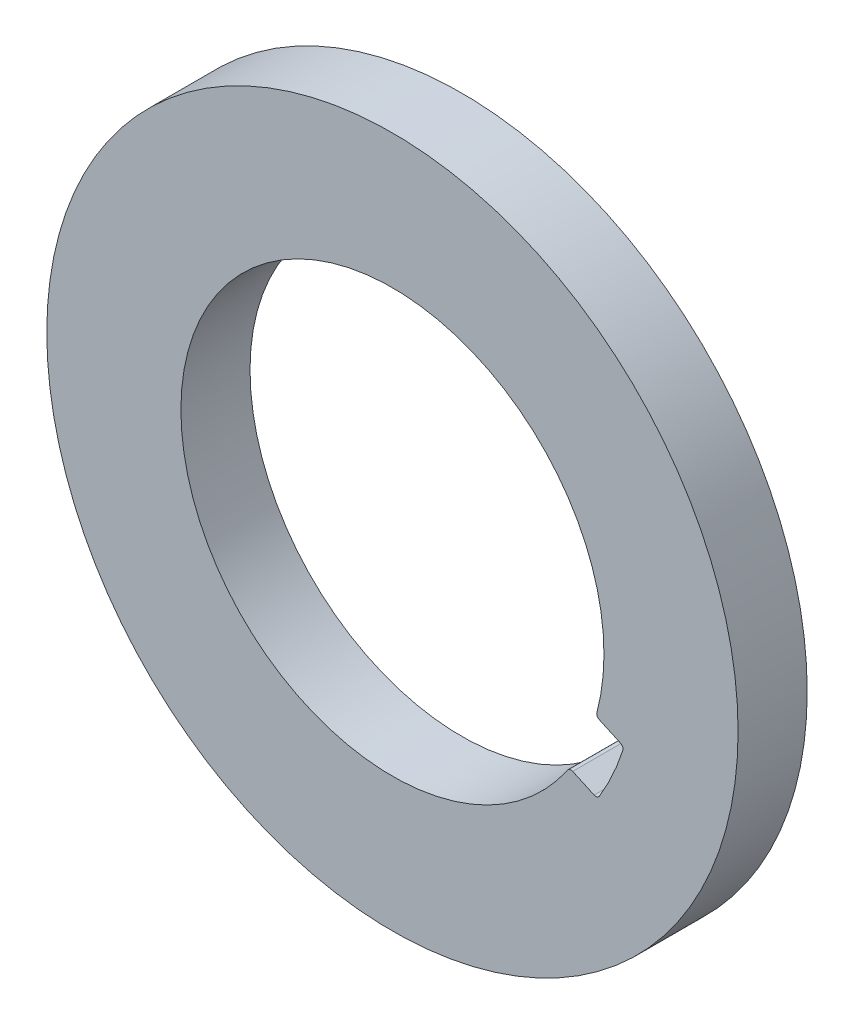
from build123d import *

# Parameters (mm, degrees)
ESQUISSE1_R        = 25
BOSS_EXTRU_1_DEPTH = 5


with BuildPart() as part:
    # Esquisse1 → Boss.-Extru.1 (new body)
    with BuildSketch(Plane.XY):
        Circle(ESQUISSE1_R)
        with BuildLine():
            Line((14.953030626, -4.277181575), (16.501758042, -4.982426557))
            ThreePointArc((16.501758042, -4.982426557), (16.651785463, -5.134087079), (16.663083329, -5.347116418))
            ThreePointArc((16.663083329, -5.347116418), (15.924531384, -7.256672806), (14.968008895, -9.066901881))
            ThreePointArc((14.968008895, -9.066901881), (14.799864591, -9.198133844), (14.587009397, -9.184458985))
            Line((14.587009397, -9.184458985), (13.038282108, -8.478683252))
            ThreePointArc((13.038282108, -8.478683252), (12.832759155, -8.462847948), (12.665533258, -8.583371557))
            ThreePointArc((12.665533258, -8.583371557), (-13.922503409, 6.344596033), (14.787409001, -3.927153556))
            ThreePointArc((14.787409001, -3.927153556), (14.806182583, -4.132467854), (14.953030626, -4.277181575))
        make_face(mode=Mode.SUBTRACT)
    extrude(amount=BOSS_EXTRU_1_DEPTH)


solid = part.part
